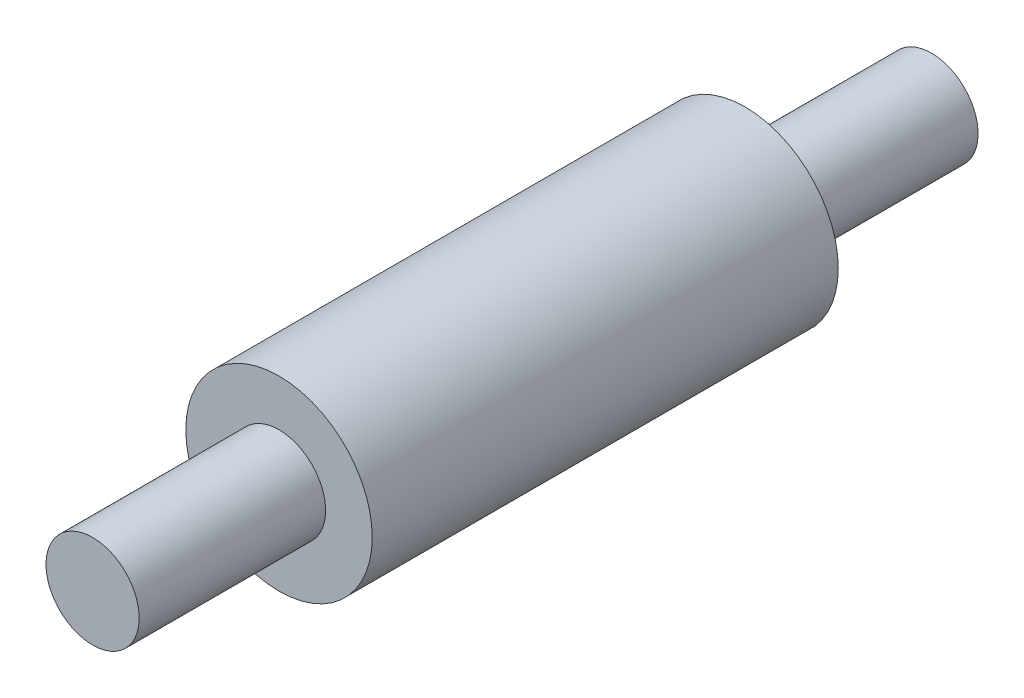
from build123d import *

# Parameters (mm, degrees)
SKETCH1_R           = 6.35
BOSS_EXTRUDE1_DEPTH = 57.15
SKETCH3_R           = 6.35
SKETCH3_R_2         = 3.175
CUT_EXTRUDE1_DEPTH  = 12.7


with BuildPart() as part:
    # Sketch1 → Boss-Extrude1 (new body)
    with BuildSketch(Plane.XY):
        Circle(SKETCH1_R)
    extrude(amount=BOSS_EXTRUDE1_DEPTH)

    # Sketch3 → Cut-Extrude1 (cut)
    with BuildSketch(Plane(origin=(0, 0, 0), x_dir=(-1, 0, 0), z_dir=(0, 0, -1))):
        Circle(SKETCH3_R)
        Circle(SKETCH3_R_2, mode=Mode.SUBTRACT)
    cut_extrude1 = extrude(amount=-CUT_EXTRUDE1_DEPTH, mode=Mode.SUBTRACT)

    # Mirror1: Cut-Extrude1 across plane
    add(cut_extrude1.mirror(Plane.XY.offset(28.575)), mode=Mode.SUBTRACT)


solid = part.part
